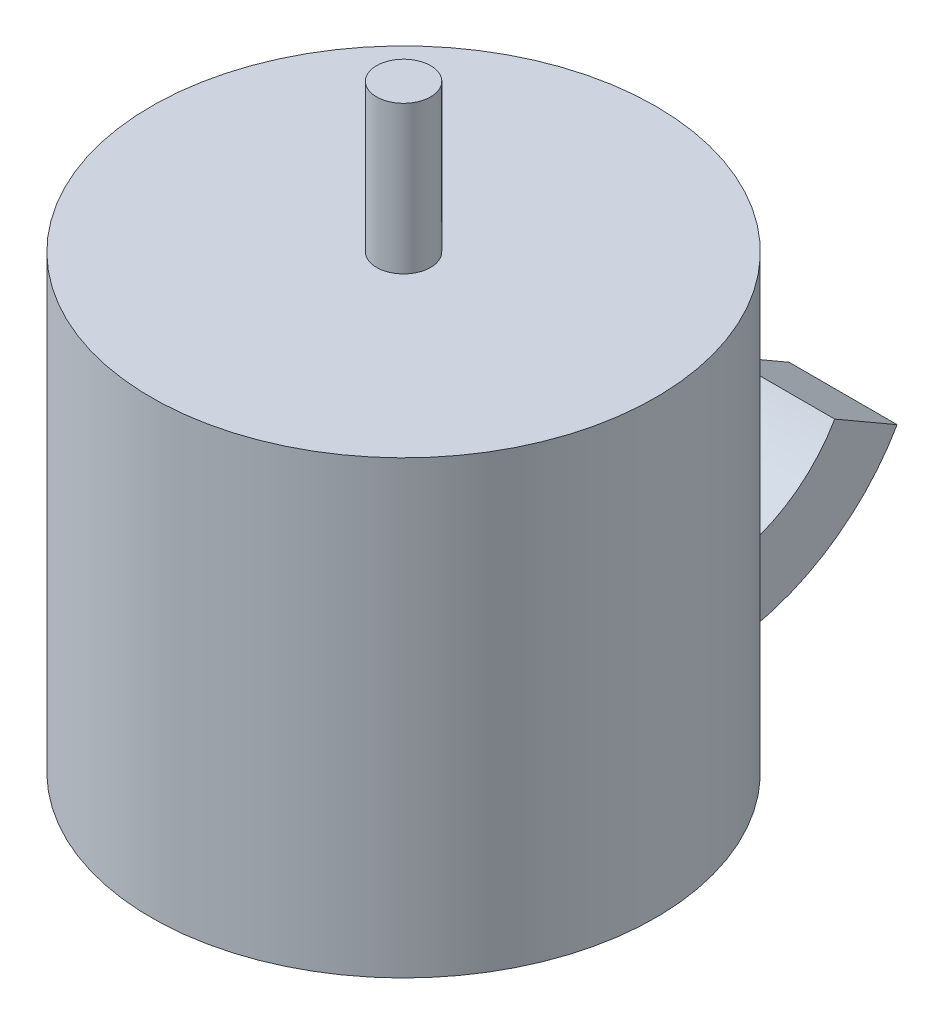
from build123d import *

# Parameters (mm, degrees)
M2X0_4_TAPPED_HOLE1_D     = 1.6
M2X0_4_TAPPED_HOLE1_DEPTH = 5.2
M2X0_4_TAPPED_HOLE1_TIP   = 0.480688495
SKETCH7_W                 = 3
SKETCH7_H                 = 2
REVOLVE3_ANGLE            = 60
REVOLVE3_OTHER_WAY_ANGLE  = 10


with BuildPart() as part:
    # Sketch1 → Revolve1 (revolve)
    with BuildSketch(Plane.XY):
        Polygon((-0.75, 0), (-7, 0), (-7, 12.5), (-0.75, 12.5), (-0.75, 16.6), (0, 16.6), (0, -0.9), (-0.75, -0.9), align=None)
    revolve(axis=Axis((0, -74.460023863, 0), (0, 1, 0)))

    # M2x0.4 Tapped Hole1
    with Locations(Plane(origin=(0, 0, 0), x_dir=(-1, 0, 0), z_dir=(0, -1, 0))):
        with Locations((3.181980515, -3.181980515), (-3.181980515, -3.181980515), (-3.181980515, 3.181980515), (3.181980515, 3.181980515)):
            Hole(M2X0_4_TAPPED_HOLE1_D / 2, depth=M2X0_4_TAPPED_HOLE1_DEPTH)
            with Locations((0, 0, -(M2X0_4_TAPPED_HOLE1_DEPTH + M2X0_4_TAPPED_HOLE1_TIP / 2))):  # 118° drill point
                Cone(0, M2X0_4_TAPPED_HOLE1_D / 2, M2X0_4_TAPPED_HOLE1_TIP, mode=Mode.SUBTRACT)

    # Sketch7 → Revolve3 (revolve)
    with BuildSketch(Plane(origin=(0, 0, -7), x_dir=(-1, 0, 0), z_dir=(0, 0, -1))):
        with Locations((0, 1)):
            Rectangle(SKETCH7_W, SKETCH7_H)
    revolve(axis=Axis((-7, 6, -7), (1, 0, 0)), revolution_arc=REVOLVE3_ANGLE)

    # Sketch7 → Revolve3 other way (revolve)
    with BuildSketch(Plane(origin=(0, 0, -7), x_dir=(-1, 0, 0), z_dir=(0, 0, -1))):
        with Locations((0, 1)):
            Rectangle(SKETCH7_W, SKETCH7_H)
    revolve(axis=Axis((-7, 6, -7), (-1, 0, 0)), revolution_arc=REVOLVE3_OTHER_WAY_ANGLE)


solid = part.part
